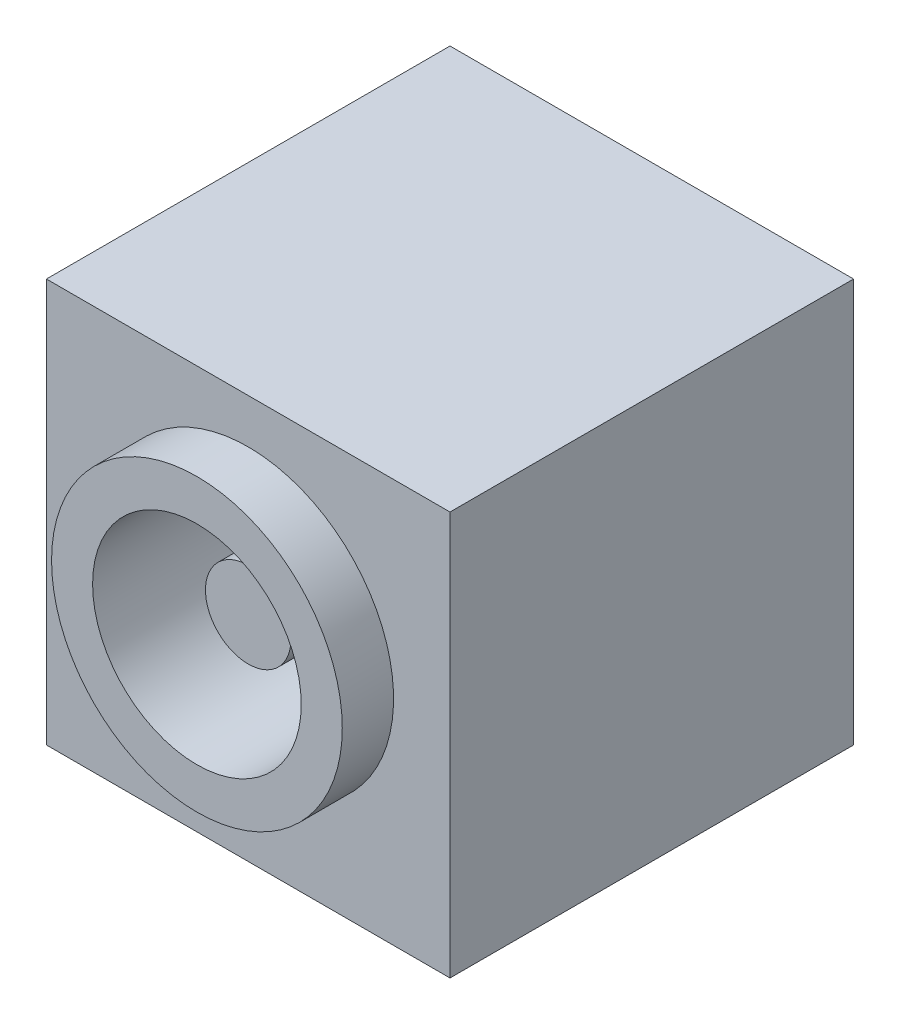
from build123d import *

# Parameters (mm, degrees)
SKETCH1_W           = 11.8
SKETCH1_H           = 11.8
BOSS_EXTRUDE1_DEPTH = 11.8
SKETCH2_R           = 4.25
BOSS_EXTRUDE2_DEPTH = 1.5
SKETCH3_R           = 3.05
CUT_EXTRUDE1_DEPTH  = 9.5
SKETCH4_R           = 1.25
BOSS_EXTRUDE3_DEPTH = 8


with BuildPart() as part:
    # Sketch1 → Boss-Extrude1 (new body)
    with BuildSketch(Plane(origin=(0, 0, 0), x_dir=(1, 0, 0), z_dir=(0, 1, 0))):
        with Locations((5.9, 5.9)):
            Rectangle(SKETCH1_W, SKETCH1_H)
    extrude(amount=BOSS_EXTRUDE1_DEPTH)

    # Sketch2 → Boss-Extrude2 (add)
    with BuildSketch(Plane.XY):
        with Locations(Location((5.9, 6.25, 0), (0, 0, 180))):
            Circle(SKETCH2_R)
    extrude(amount=BOSS_EXTRUDE2_DEPTH)

    # Sketch3 → Cut-Extrude1 (cut)
    with BuildSketch(Plane.XY.offset(1.5)):
        with Locations((5.9, 6.25)):
            Circle(SKETCH3_R)
    extrude(amount=-CUT_EXTRUDE1_DEPTH, mode=Mode.SUBTRACT)

    # Sketch4 → Boss-Extrude3 (add)
    with BuildSketch(Plane.XY.offset(-8)):
        with Locations((5.9, 6.25)):
            Circle(SKETCH4_R)
    extrude(amount=BOSS_EXTRUDE3_DEPTH)


solid = part.part
